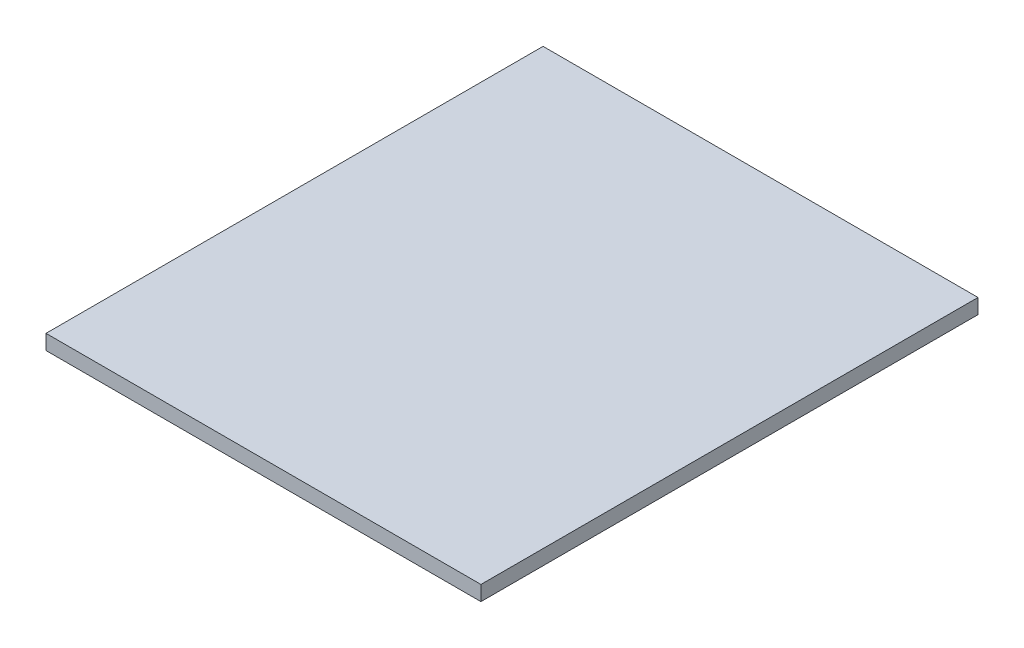
from build123d import *

# Parameters (mm, degrees)
ESBO_O1_W                = 175
ESBO_O1_H                = 200
RESSALTO_EXTRUS_O1_DEPTH = 6


with BuildPart() as part:
    # Esboço1 → Ressalto-extrusão1 (new body)
    with BuildSketch(Plane(origin=(0, 0, 0), x_dir=(1, 0, 0), z_dir=(0, 1, 0))):
        Rectangle(ESBO_O1_W, ESBO_O1_H)
    extrude(amount=RESSALTO_EXTRUS_O1_DEPTH)


solid = part.part
